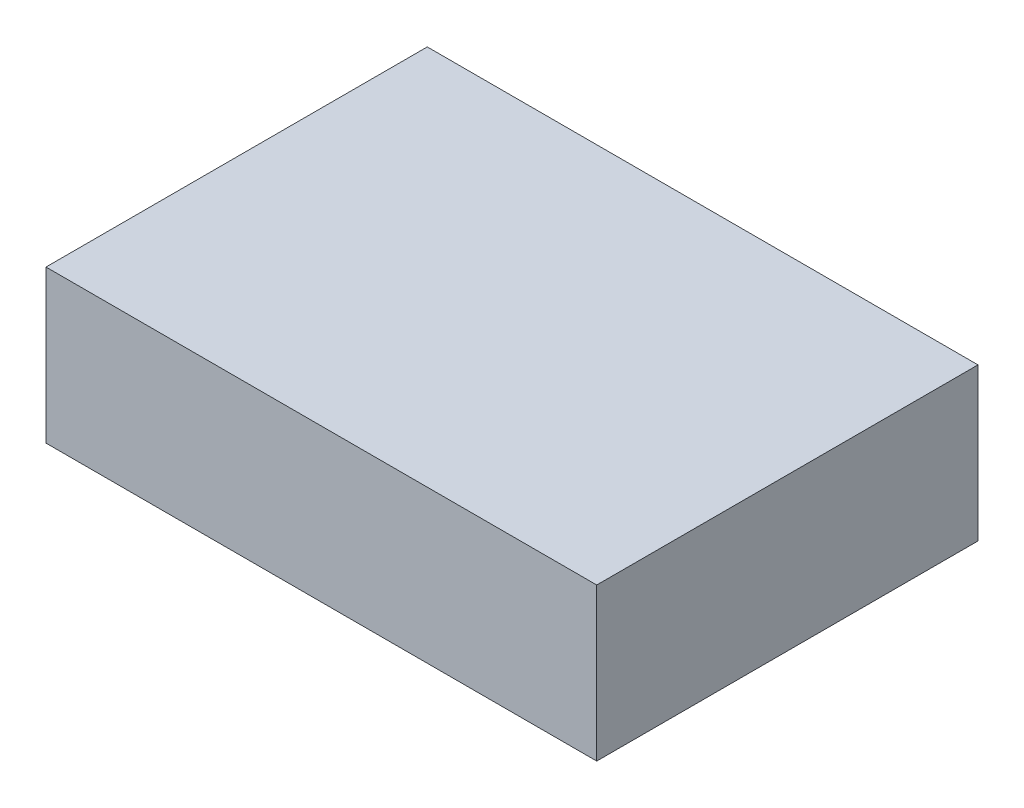
from build123d import *

# Parameters (mm, degrees)
SKETCH1_W           = 33.02
SKETCH1_H           = 22.86
BOSS_EXTRUDE1_DEPTH = 9.144


with BuildPart() as part:
    # Sketch1 → Boss-Extrude1 (new body)
    with BuildSketch(Plane(origin=(0, 0, 0), x_dir=(1, 0, 0), z_dir=(0, 1, 0))):
        Rectangle(SKETCH1_W, SKETCH1_H)
    extrude(amount=BOSS_EXTRUDE1_DEPTH)


solid = part.part
